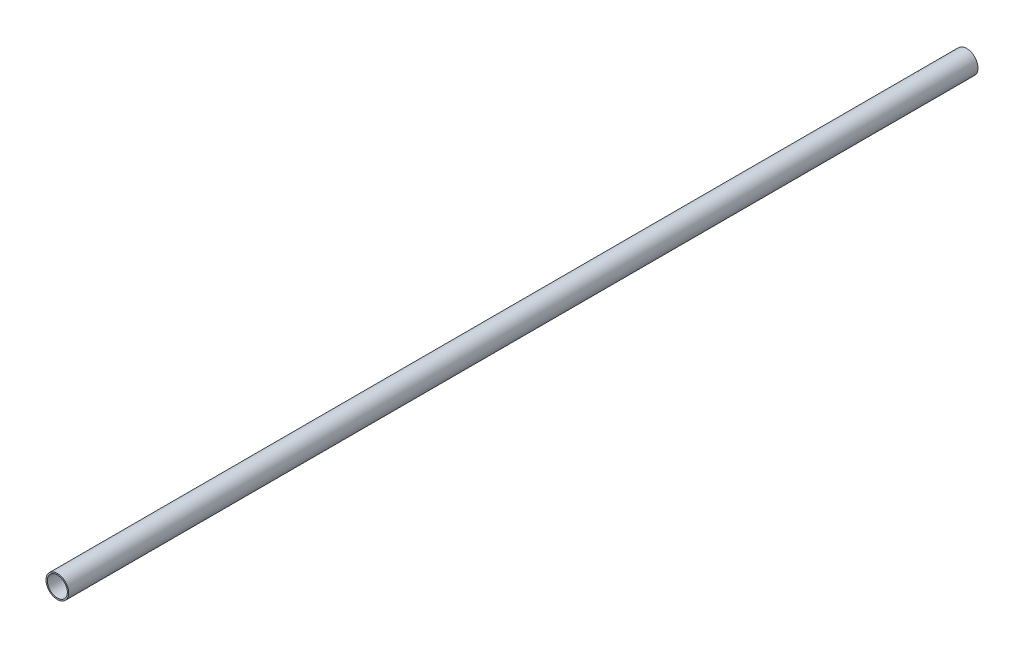
from build123d import *

# Parameters (mm, degrees)
BOSS_EXTRUDE1_DEPTH      = 500
BOSS_EXTRUDE1_DEPTH_BACK = 500
SKETCH1_R                = 12.5
SKETCH1_R_2              = 11


with BuildPart() as part:
    # Sketch1 → Boss-Extrude1 (new, two sides: drawn at the far end of the back side and taken through both)
    with BuildSketch(Plane.XY.offset(-BOSS_EXTRUDE1_DEPTH_BACK)):
        Circle(SKETCH1_R)
        Circle(SKETCH1_R_2, mode=Mode.SUBTRACT)
    extrude(amount=BOSS_EXTRUDE1_DEPTH + BOSS_EXTRUDE1_DEPTH_BACK)


solid = part.part
